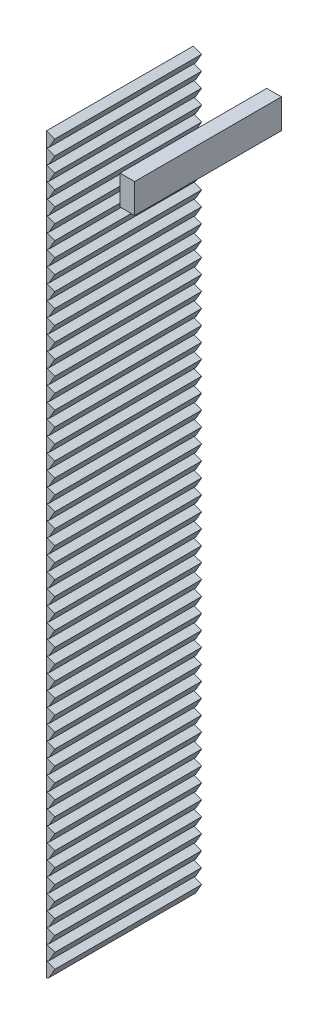
from build123d import *

# Parameters (mm, degrees)
SKETCH_2_W             = 10
SKETCH_2_H             = 20
EXTRUDE_2_DEPTH        = 100
EXTRUDE_1_DEPTH        = 100
PATTERN_LINEAR_1_COUNT = 50
PATTERN_LINEAR_1_PITCH = 10


with BuildPart() as part:
    # 草圖2 → 填料-伸長2 (new body)
    with BuildSketch(Plane.XY):
        with Locations((55, 490)):
            Rectangle(SKETCH_2_W, SKETCH_2_H)
    extrude(amount=EXTRUDE_2_DEPTH)


with BuildPart() as body_2:
    # 草圖1 → 填料-伸長1 (new body)
    with BuildSketch(Plane.XY):
        Polygon((0, 0), (0, 10), (5.638155725, 7.94787914), (1.574168346, 0.908846518), align=None)
    extrude(amount=EXTRUDE_1_DEPTH)


with BuildPart() as pattern_linear_1_1:
    # 直線複製排列1: pattern copy
    add(body_2.part.moved(Location(Vector(0, 1, 0) * (1 * PATTERN_LINEAR_1_PITCH))))


with BuildPart() as pattern_linear_1_2:
    # 直線複製排列1: pattern copy
    add(body_2.part.moved(Location(Vector(0, 1, 0) * (2 * PATTERN_LINEAR_1_PITCH))))


with BuildPart() as pattern_linear_1_3:
    # 直線複製排列1: pattern copy
    add(body_2.part.moved(Location(Vector(0, 1, 0) * (3 * PATTERN_LINEAR_1_PITCH))))


with BuildPart() as pattern_linear_1_4:
    # 直線複製排列1: pattern copy
    add(body_2.part.moved(Location(Vector(0, 1, 0) * (4 * PATTERN_LINEAR_1_PITCH))))


with BuildPart() as pattern_linear_1_5:
    # 直線複製排列1: pattern copy
    add(body_2.part.moved(Location(Vector(0, 1, 0) * (5 * PATTERN_LINEAR_1_PITCH))))


with BuildPart() as pattern_linear_1_6:
    # 直線複製排列1: pattern copy
    add(body_2.part.moved(Location(Vector(0, 1, 0) * (6 * PATTERN_LINEAR_1_PITCH))))


with BuildPart() as pattern_linear_1_7:
    # 直線複製排列1: pattern copy
    add(body_2.part.moved(Location(Vector(0, 1, 0) * (7 * PATTERN_LINEAR_1_PITCH))))


with BuildPart() as pattern_linear_1_8:
    # 直線複製排列1: pattern copy
    add(body_2.part.moved(Location(Vector(0, 1, 0) * (8 * PATTERN_LINEAR_1_PITCH))))


with BuildPart() as pattern_linear_1_9:
    # 直線複製排列1: pattern copy
    add(body_2.part.moved(Location(Vector(0, 1, 0) * (9 * PATTERN_LINEAR_1_PITCH))))


with BuildPart() as pattern_linear_1_10:
    # 直線複製排列1: pattern copy
    add(body_2.part.moved(Location(Vector(0, 1, 0) * (10 * PATTERN_LINEAR_1_PITCH))))


with BuildPart() as pattern_linear_1_11:
    # 直線複製排列1: pattern copy
    add(body_2.part.moved(Location(Vector(0, 1, 0) * (11 * PATTERN_LINEAR_1_PITCH))))


with BuildPart() as pattern_linear_1_12:
    # 直線複製排列1: pattern copy
    add(body_2.part.moved(Location(Vector(0, 1, 0) * (12 * PATTERN_LINEAR_1_PITCH))))


with BuildPart() as pattern_linear_1_13:
    # 直線複製排列1: pattern copy
    add(body_2.part.moved(Location(Vector(0, 1, 0) * (13 * PATTERN_LINEAR_1_PITCH))))


with BuildPart() as pattern_linear_1_14:
    # 直線複製排列1: pattern copy
    add(body_2.part.moved(Location(Vector(0, 1, 0) * (14 * PATTERN_LINEAR_1_PITCH))))


with BuildPart() as pattern_linear_1_15:
    # 直線複製排列1: pattern copy
    add(body_2.part.moved(Location(Vector(0, 1, 0) * (15 * PATTERN_LINEAR_1_PITCH))))


with BuildPart() as pattern_linear_1_16:
    # 直線複製排列1: pattern copy
    add(body_2.part.moved(Location(Vector(0, 1, 0) * (16 * PATTERN_LINEAR_1_PITCH))))


with BuildPart() as pattern_linear_1_17:
    # 直線複製排列1: pattern copy
    add(body_2.part.moved(Location(Vector(0, 1, 0) * (17 * PATTERN_LINEAR_1_PITCH))))


with BuildPart() as pattern_linear_1_18:
    # 直線複製排列1: pattern copy
    add(body_2.part.moved(Location(Vector(0, 1, 0) * (18 * PATTERN_LINEAR_1_PITCH))))


with BuildPart() as pattern_linear_1_19:
    # 直線複製排列1: pattern copy
    add(body_2.part.moved(Location(Vector(0, 1, 0) * (19 * PATTERN_LINEAR_1_PITCH))))


with BuildPart() as pattern_linear_1_20:
    # 直線複製排列1: pattern copy
    add(body_2.part.moved(Location(Vector(0, 1, 0) * (20 * PATTERN_LINEAR_1_PITCH))))


with BuildPart() as pattern_linear_1_21:
    # 直線複製排列1: pattern copy
    add(body_2.part.moved(Location(Vector(0, 1, 0) * (21 * PATTERN_LINEAR_1_PITCH))))


with BuildPart() as pattern_linear_1_22:
    # 直線複製排列1: pattern copy
    add(body_2.part.moved(Location(Vector(0, 1, 0) * (22 * PATTERN_LINEAR_1_PITCH))))


with BuildPart() as pattern_linear_1_23:
    # 直線複製排列1: pattern copy
    add(body_2.part.moved(Location(Vector(0, 1, 0) * (23 * PATTERN_LINEAR_1_PITCH))))


with BuildPart() as pattern_linear_1_24:
    # 直線複製排列1: pattern copy
    add(body_2.part.moved(Location(Vector(0, 1, 0) * (24 * PATTERN_LINEAR_1_PITCH))))


with BuildPart() as pattern_linear_1_25:
    # 直線複製排列1: pattern copy
    add(body_2.part.moved(Location(Vector(0, 1, 0) * (25 * PATTERN_LINEAR_1_PITCH))))


with BuildPart() as pattern_linear_1_26:
    # 直線複製排列1: pattern copy
    add(body_2.part.moved(Location(Vector(0, 1, 0) * (26 * PATTERN_LINEAR_1_PITCH))))


with BuildPart() as pattern_linear_1_27:
    # 直線複製排列1: pattern copy
    add(body_2.part.moved(Location(Vector(0, 1, 0) * (27 * PATTERN_LINEAR_1_PITCH))))


with BuildPart() as pattern_linear_1_28:
    # 直線複製排列1: pattern copy
    add(body_2.part.moved(Location(Vector(0, 1, 0) * (28 * PATTERN_LINEAR_1_PITCH))))


with BuildPart() as pattern_linear_1_29:
    # 直線複製排列1: pattern copy
    add(body_2.part.moved(Location(Vector(0, 1, 0) * (29 * PATTERN_LINEAR_1_PITCH))))


with BuildPart() as pattern_linear_1_30:
    # 直線複製排列1: pattern copy
    add(body_2.part.moved(Location(Vector(0, 1, 0) * (30 * PATTERN_LINEAR_1_PITCH))))


with BuildPart() as pattern_linear_1_31:
    # 直線複製排列1: pattern copy
    add(body_2.part.moved(Location(Vector(0, 1, 0) * (31 * PATTERN_LINEAR_1_PITCH))))


with BuildPart() as pattern_linear_1_32:
    # 直線複製排列1: pattern copy
    add(body_2.part.moved(Location(Vector(0, 1, 0) * (32 * PATTERN_LINEAR_1_PITCH))))


with BuildPart() as pattern_linear_1_33:
    # 直線複製排列1: pattern copy
    add(body_2.part.moved(Location(Vector(0, 1, 0) * (33 * PATTERN_LINEAR_1_PITCH))))


with BuildPart() as pattern_linear_1_34:
    # 直線複製排列1: pattern copy
    add(body_2.part.moved(Location(Vector(0, 1, 0) * (34 * PATTERN_LINEAR_1_PITCH))))


with BuildPart() as pattern_linear_1_35:
    # 直線複製排列1: pattern copy
    add(body_2.part.moved(Location(Vector(0, 1, 0) * (35 * PATTERN_LINEAR_1_PITCH))))


with BuildPart() as pattern_linear_1_36:
    # 直線複製排列1: pattern copy
    add(body_2.part.moved(Location(Vector(0, 1, 0) * (36 * PATTERN_LINEAR_1_PITCH))))


with BuildPart() as pattern_linear_1_37:
    # 直線複製排列1: pattern copy
    add(body_2.part.moved(Location(Vector(0, 1, 0) * (37 * PATTERN_LINEAR_1_PITCH))))


with BuildPart() as pattern_linear_1_38:
    # 直線複製排列1: pattern copy
    add(body_2.part.moved(Location(Vector(0, 1, 0) * (38 * PATTERN_LINEAR_1_PITCH))))


with BuildPart() as pattern_linear_1_39:
    # 直線複製排列1: pattern copy
    add(body_2.part.moved(Location(Vector(0, 1, 0) * (39 * PATTERN_LINEAR_1_PITCH))))


with BuildPart() as pattern_linear_1_40:
    # 直線複製排列1: pattern copy
    add(body_2.part.moved(Location(Vector(0, 1, 0) * (40 * PATTERN_LINEAR_1_PITCH))))


with BuildPart() as pattern_linear_1_41:
    # 直線複製排列1: pattern copy
    add(body_2.part.moved(Location(Vector(0, 1, 0) * (41 * PATTERN_LINEAR_1_PITCH))))


with BuildPart() as pattern_linear_1_42:
    # 直線複製排列1: pattern copy
    add(body_2.part.moved(Location(Vector(0, 1, 0) * (42 * PATTERN_LINEAR_1_PITCH))))


with BuildPart() as pattern_linear_1_43:
    # 直線複製排列1: pattern copy
    add(body_2.part.moved(Location(Vector(0, 1, 0) * (43 * PATTERN_LINEAR_1_PITCH))))


with BuildPart() as pattern_linear_1_44:
    # 直線複製排列1: pattern copy
    add(body_2.part.moved(Location(Vector(0, 1, 0) * (44 * PATTERN_LINEAR_1_PITCH))))


with BuildPart() as pattern_linear_1_45:
    # 直線複製排列1: pattern copy
    add(body_2.part.moved(Location(Vector(0, 1, 0) * (45 * PATTERN_LINEAR_1_PITCH))))


with BuildPart() as pattern_linear_1_46:
    # 直線複製排列1: pattern copy
    add(body_2.part.moved(Location(Vector(0, 1, 0) * (46 * PATTERN_LINEAR_1_PITCH))))


with BuildPart() as pattern_linear_1_47:
    # 直線複製排列1: pattern copy
    add(body_2.part.moved(Location(Vector(0, 1, 0) * (47 * PATTERN_LINEAR_1_PITCH))))


with BuildPart() as pattern_linear_1_48:
    # 直線複製排列1: pattern copy
    add(body_2.part.moved(Location(Vector(0, 1, 0) * (48 * PATTERN_LINEAR_1_PITCH))))


with BuildPart() as pattern_linear_1_49:
    # 直線複製排列1: pattern copy
    add(body_2.part.moved(Location(Vector(0, 1, 0) * (49 * PATTERN_LINEAR_1_PITCH))))


solid = Compound([part.part, body_2.part, pattern_linear_1_1.part, pattern_linear_1_2.part, pattern_linear_1_3.part, pattern_linear_1_4.part, pattern_linear_1_5.part, pattern_linear_1_6.part, pattern_linear_1_7.part, pattern_linear_1_8.part, pattern_linear_1_9.part, pattern_linear_1_10.part, pattern_linear_1_11.part, pattern_linear_1_12.part, pattern_linear_1_13.part, pattern_linear_1_14.part, pattern_linear_1_15.part, pattern_linear_1_16.part, pattern_linear_1_17.part, pattern_linear_1_18.part, pattern_linear_1_19.part, pattern_linear_1_20.part, pattern_linear_1_21.part, pattern_linear_1_22.part, pattern_linear_1_23.part, pattern_linear_1_24.part, pattern_linear_1_25.part, pattern_linear_1_26.part, pattern_linear_1_27.part, pattern_linear_1_28.part, pattern_linear_1_29.part, pattern_linear_1_30.part, pattern_linear_1_31.part, pattern_linear_1_32.part, pattern_linear_1_33.part, pattern_linear_1_34.part, pattern_linear_1_35.part, pattern_linear_1_36.part, pattern_linear_1_37.part, pattern_linear_1_38.part, pattern_linear_1_39.part, pattern_linear_1_40.part, pattern_linear_1_41.part, pattern_linear_1_42.part, pattern_linear_1_43.part, pattern_linear_1_44.part, pattern_linear_1_45.part, pattern_linear_1_46.part, pattern_linear_1_47.part, pattern_linear_1_48.part, pattern_linear_1_49.part])
